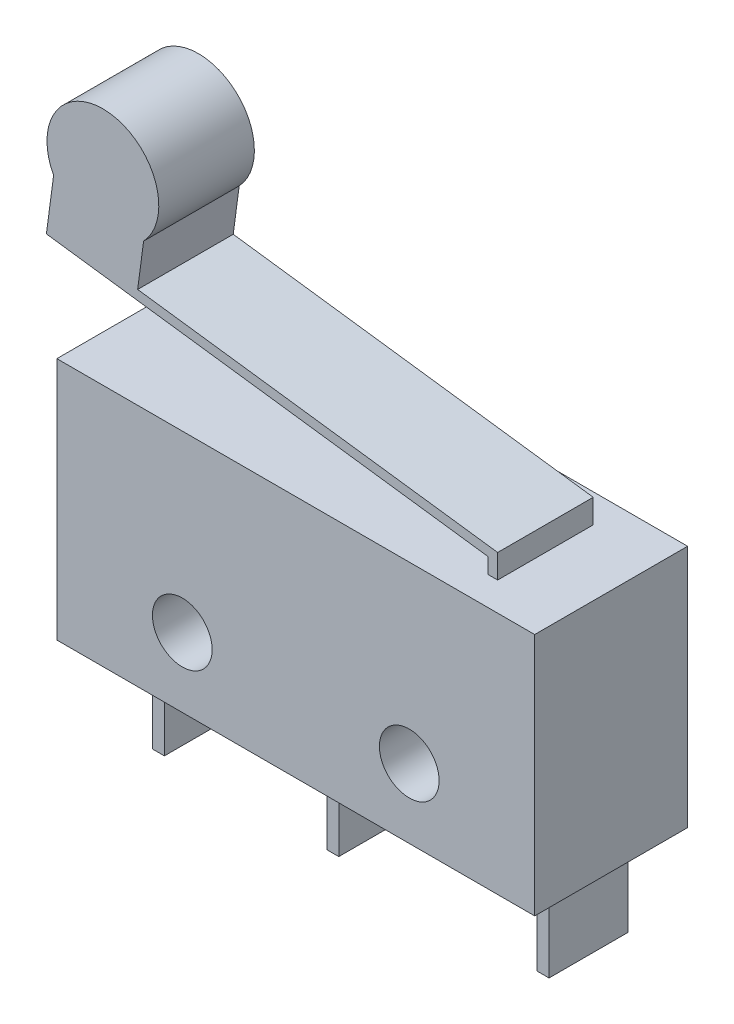
from build123d import *

# Parameters (mm, degrees)
SKETCH1_W           = 20
SKETCH1_H           = 10.2
SKETCH1_R           = 1.25
BOSS_EXTRUDE1_DEPTH = 3.2
BOSS_EXTRUDE2_DEPTH = 2
SKETCH3_W           = 3.3
SKETCH3_H           = 3.5
BOSS_EXTRUDE3_DEPTH = 0.25
BOSS_EXTRUDE4_START = 8.8
SKETCH3_2_W         = 3.3
SKETCH3_2_H         = 3.5
BOSS_EXTRUDE4_DEPTH = 0.25
BOSS_EXTRUDE5_START = -7.3
SKETCH3_3_W         = 3.3
SKETCH3_3_H         = 3.5
BOSS_EXTRUDE5_DEPTH = 0.25


with BuildPart() as part:
    # Sketch1 → Boss-Extrude1 (new, symmetric)
    with BuildSketch(Plane.XY):
        Rectangle(SKETCH1_W, SKETCH1_H)
        with Locations((-4.75, -2.2)):
            Circle(SKETCH1_R, mode=Mode.SUBTRACT)
        with Locations((4.75, -2.2)):
            Circle(SKETCH1_R, mode=Mode.SUBTRACT)
    extrude(amount=BOSS_EXTRUDE1_DEPTH, both=True)

    # Sketch2 → Boss-Extrude2 (add, symmetric)
    with BuildSketch(Plane.XY):
        with BuildLine():
            Line((7.25, 5.1), (6.85, 5.1))
            Line((6.85, 5.1), (6.85, 5.749556363))
            Line((6.85, 5.749556363), (-11.637609905, 8.201949589))
            Line((-11.637609905, 8.201949589), (-11.335934652, 10.476158449))
            ThreePointArc((-11.335934652, 10.476158449), (-8.965116404, 13.9), (-7.56893257, 9.976463224))
            Line((-7.56893257, 9.976463224), (-7.818008326, 8.098780899))
            Line((-7.818008326, 8.098780899), (7.25, 6.1))
            Line((7.25, 6.1), (7.25, 5.1))
        make_face()
    extrude(amount=BOSS_EXTRUDE2_DEPTH, both=True)

    # Sketch3 → Boss-Extrude3 (add, symmetric)
    with BuildSketch(Plane(origin=(0, 0, 0), x_dir=(0, 0, -1), z_dir=(1, 0, 0))):
        with Locations((0, -6.85)):
            Rectangle(SKETCH3_W, SKETCH3_H)
    extrude(amount=BOSS_EXTRUDE3_DEPTH, both=True)

    # Sketch3<2> → Boss-Extrude4 (add, symmetric)
    with BuildSketch(Plane(origin=(0, 0, 0), x_dir=(0, 0, -1), z_dir=(1, 0, 0)).offset(BOSS_EXTRUDE4_START)):
        with Locations((0, -6.85)):
            Rectangle(SKETCH3_2_W, SKETCH3_2_H)
    extrude(amount=BOSS_EXTRUDE4_DEPTH, both=True)

    # Sketch3<3> → Boss-Extrude5 (add, symmetric)
    with BuildSketch(Plane(origin=(0, 0, 0), x_dir=(0, 0, -1), z_dir=(1, 0, 0)).offset(BOSS_EXTRUDE5_START)):
        with Locations((0, -6.85)):
            Rectangle(SKETCH3_3_W, SKETCH3_3_H)
    extrude(amount=BOSS_EXTRUDE5_DEPTH, both=True)


solid = part.part
